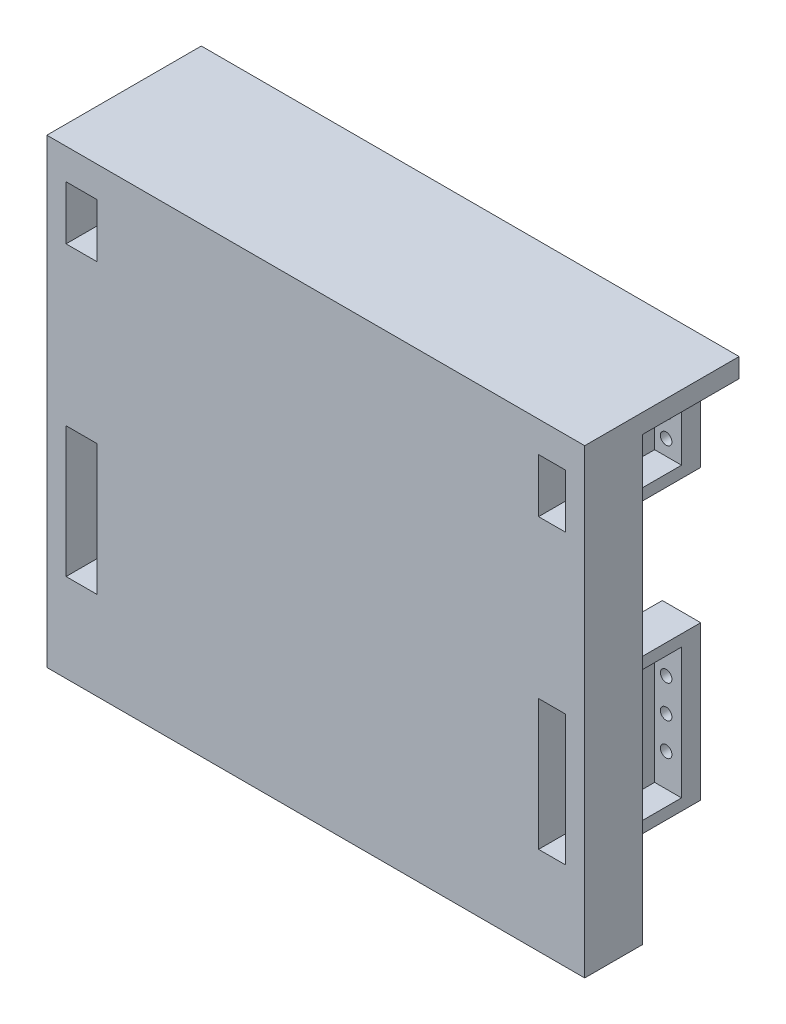
from build123d import *

# Parameters (mm, degrees)
SKETCH_1_W          = 140
SKETCH_1_H          = 120
EXTRUDE_1_DEPTH     = 5
SKETCH_2_W          = 140
SKETCH_2_H          = 5
EXTRUDE_2_DEPTH     = 35.2
SKETCH_5_W          = 10
SKETCH_5_H          = 40
SKETCH_5_H_2        = 20
EXTRUDE_3_DEPTH     = 30.2
SKETCH_6_W          = 8
SKETCH_6_H          = 14
SKETCH_6_H_2        = 34
SKETCH_6_W_2        = 7
CUT_EXTRUDE_1_DEPTH = 30.2
CUT_EXTRUDE_2_DEPTH = 102.972271659
SKETCH_11_W         = 5
SKETCH_11_H         = 115
EXTRUDE_4_DEPTH     = 10


with BuildPart() as part:
    # 스케치1 → 보스-돌출1 (new body)
    with BuildSketch(Plane.XY):
        with Locations((5.094369335, 2.025316456)):
            Rectangle(SKETCH_1_W, SKETCH_1_H)
    extrude(amount=EXTRUDE_1_DEPTH)

    # 스케치2 → 보스-돌출2 (add)
    with BuildSketch(Plane(origin=(0, 0, 0), x_dir=(-1, 0, 0), z_dir=(0, 0, -1))):
        with Locations((-5.094369335, 59.525316456)):
            Rectangle(SKETCH_2_W, SKETCH_2_H)
    extrude(amount=EXTRUDE_2_DEPTH)

    # 스케치5 → 보스-돌출3 (add)
    with BuildSketch(Plane(origin=(0, 0, 0), x_dir=(-1, 0, 0), z_dir=(0, 0, -1))):
        with Locations((-65.094369335, -17.974683544)):
            Rectangle(SKETCH_5_W, SKETCH_5_H)
        with Locations((-65.094369335, 47.025316456)):
            Rectangle(SKETCH_5_W, SKETCH_5_H_2)
        with Locations((54.905630665, -17.974683544)):
            Rectangle(SKETCH_5_W, SKETCH_5_H)
        with Locations((54.905630665, 47.025316456)):
            Rectangle(SKETCH_5_W, SKETCH_5_H_2)
    extrude(amount=EXTRUDE_3_DEPTH)

    # 스케치6 → 컷-돌출1 (cut)
    with BuildSketch(Plane.XY.offset(5)):
        with Locations((-55.905630665, 47.025316456)):
            Rectangle(SKETCH_6_W, SKETCH_6_H)
        with Locations((-55.905630665, -17.974683544)):
            Rectangle(SKETCH_6_W, SKETCH_6_H_2)
        Polygon((63.622466752, -0.974683544), (63.094369335, -0.974683544), (63.094369335, -34.974683544), (70.094369335, -34.974683544), (70.094369335, -0.974683544), align=None)
        with Locations((66.594369335, 47.025316456)):
            Rectangle(SKETCH_6_W_2, SKETCH_6_H)
    extrude(amount=-CUT_EXTRUDE_1_DEPTH, mode=Mode.SUBTRACT)

    # 스케치8 → 컷-돌출2 (cut, through all)
    with BuildSketch(Plane.XY.offset(-25.2)):
        with BuildLine():
            ThreePointArc((-54.405630665, 44.025316456), (-54.844970493, 45.085976627), (-55.905630665, 45.525316456))
            Line((-55.905630665, 45.525316456), (-55.905630665, 42.525316456))
            ThreePointArc((-55.905630665, 42.525316456), (-54.844970493, 42.964656284), (-54.405630665, 44.025316456))
        make_face()
        with BuildLine():
            Line((-55.905630665, 42.525316456), (-55.905630665, 45.525316456))
            ThreePointArc((-55.905630665, 45.525316456), (-57.405630665, 44.025316456), (-55.905630665, 42.525316456))
        make_face()
        with BuildLine():
            ThreePointArc((-54.405630665, 50.025316456), (-54.844970493, 51.085976627), (-55.905630665, 51.525316456))
            Line((-55.905630665, 51.525316456), (-55.905630665, 48.525316456))
            ThreePointArc((-55.905630665, 48.525316456), (-54.844970493, 48.964656284), (-54.405630665, 50.025316456))
        make_face()
        with BuildLine():
            Line((-55.905630665, 48.525316456), (-55.905630665, 51.525316456))
            ThreePointArc((-55.905630665, 51.525316456), (-57.405630665, 50.025316456), (-55.905630665, 48.525316456))
        make_face()
        with BuildLine():
            ThreePointArc((-54.405630665, -9.474683544), (-54.844970493, -8.414023373), (-55.905630665, -7.974683544))
            Line((-55.905630665, -7.974683544), (-55.905630665, -10.974683544))
            ThreePointArc((-55.905630665, -10.974683544), (-54.844970493, -10.535343716), (-54.405630665, -9.474683544))
        make_face()
        with BuildLine():
            Line((-55.905630665, -10.974683544), (-55.905630665, -7.974683544))
            ThreePointArc((-55.905630665, -7.974683544), (-57.405630665, -9.474683544), (-55.905630665, -10.974683544))
        make_face()
        with BuildLine():
            ThreePointArc((-54.405630665, -17.974683544), (-54.844970493, -16.914023373), (-55.905630665, -16.474683544))
            Line((-55.905630665, -16.474683544), (-55.905630665, -19.474683544))
            ThreePointArc((-55.905630665, -19.474683544), (-54.844970493, -19.035343716), (-54.405630665, -17.974683544))
        make_face()
        with BuildLine():
            Line((-55.905630665, -19.474683544), (-55.905630665, -16.474683544))
            ThreePointArc((-55.905630665, -16.474683544), (-57.405630665, -17.974683544), (-55.905630665, -19.474683544))
        make_face()
        with BuildLine():
            ThreePointArc((-54.405630665, -26.474683544), (-54.844970493, -25.414023373), (-55.905630665, -24.974683544))
            Line((-55.905630665, -24.974683544), (-55.905630665, -27.974683544))
            ThreePointArc((-55.905630665, -27.974683544), (-54.844970493, -27.535343716), (-54.405630665, -26.474683544))
        make_face()
        with BuildLine():
            Line((-55.905630665, -27.974683544), (-55.905630665, -24.974683544))
            ThreePointArc((-55.905630665, -24.974683544), (-57.405630665, -26.474683544), (-55.905630665, -27.974683544))
        make_face()
        with BuildLine():
            ThreePointArc((67.594369335, -26.474683544), (67.155029507, -25.414023373), (66.094369335, -24.974683544))
            Line((66.094369335, -24.974683544), (66.094369335, -27.974683544))
            ThreePointArc((66.094369335, -27.974683544), (67.155029507, -27.535343716), (67.594369335, -26.474683544))
        make_face()
        with BuildLine():
            Line((66.094369335, -27.974683544), (66.094369335, -24.974683544))
            ThreePointArc((66.094369335, -24.974683544), (64.594369335, -26.474683544), (66.094369335, -27.974683544))
        make_face()
        with BuildLine():
            ThreePointArc((67.594369335, -17.974683544), (67.155029507, -16.914023373), (66.094369335, -16.474683544))
            Line((66.094369335, -16.474683544), (66.094369335, -19.474683544))
            ThreePointArc((66.094369335, -19.474683544), (67.155029507, -19.035343716), (67.594369335, -17.974683544))
        make_face()
        with BuildLine():
            Line((66.094369335, -19.474683544), (66.094369335, -16.474683544))
            ThreePointArc((66.094369335, -16.474683544), (64.594369335, -17.974683544), (66.094369335, -19.474683544))
        make_face()
        with BuildLine():
            ThreePointArc((67.594369335, -9.474683544), (67.155029507, -8.414023373), (66.094369335, -7.974683544))
            Line((66.094369335, -7.974683544), (66.094369335, -10.974683544))
            ThreePointArc((66.094369335, -10.974683544), (67.155029507, -10.535343716), (67.594369335, -9.474683544))
        make_face()
        with BuildLine():
            Line((66.094369335, -10.974683544), (66.094369335, -7.974683544))
            ThreePointArc((66.094369335, -7.974683544), (64.594369335, -9.474683544), (66.094369335, -10.974683544))
        make_face()
        with BuildLine():
            ThreePointArc((67.594369335, 44.025316456), (67.155029507, 45.085976627), (66.094369335, 45.525316456))
            Line((66.094369335, 45.525316456), (66.094369335, 42.525316456))
            ThreePointArc((66.094369335, 42.525316456), (67.155029507, 42.964656284), (67.594369335, 44.025316456))
        make_face()
        with BuildLine():
            Line((66.094369335, 42.525316456), (66.094369335, 45.525316456))
            ThreePointArc((66.094369335, 45.525316456), (64.594369335, 44.025316456), (66.094369335, 42.525316456))
        make_face()
        with BuildLine():
            ThreePointArc((67.594369335, 50.025316456), (67.155029507, 51.085976627), (66.094369335, 51.525316456))
            Line((66.094369335, 51.525316456), (66.094369335, 48.525316456))
            ThreePointArc((66.094369335, 48.525316456), (67.155029507, 48.964656284), (67.594369335, 50.025316456))
        make_face()
        with BuildLine():
            Line((66.094369335, 48.525316456), (66.094369335, 51.525316456))
            ThreePointArc((66.094369335, 51.525316456), (64.594369335, 50.025316456), (66.094369335, 48.525316456))
        make_face()
    extrude(amount=-CUT_EXTRUDE_2_DEPTH, mode=Mode.SUBTRACT)

    # 스케치11 → 보스-돌출4 (add)
    with BuildSketch(Plane(origin=(0, 0, 0), x_dir=(-1, 0, 0), z_dir=(0, 0, -1))):
        with Locations((62.405630665, -0.474683544)):
            Rectangle(SKETCH_11_W, SKETCH_11_H)
        with Locations((-72.594369335, -0.474683544)):
            Rectangle(SKETCH_11_W, SKETCH_11_H)
    extrude(amount=EXTRUDE_4_DEPTH)


solid = part.part
